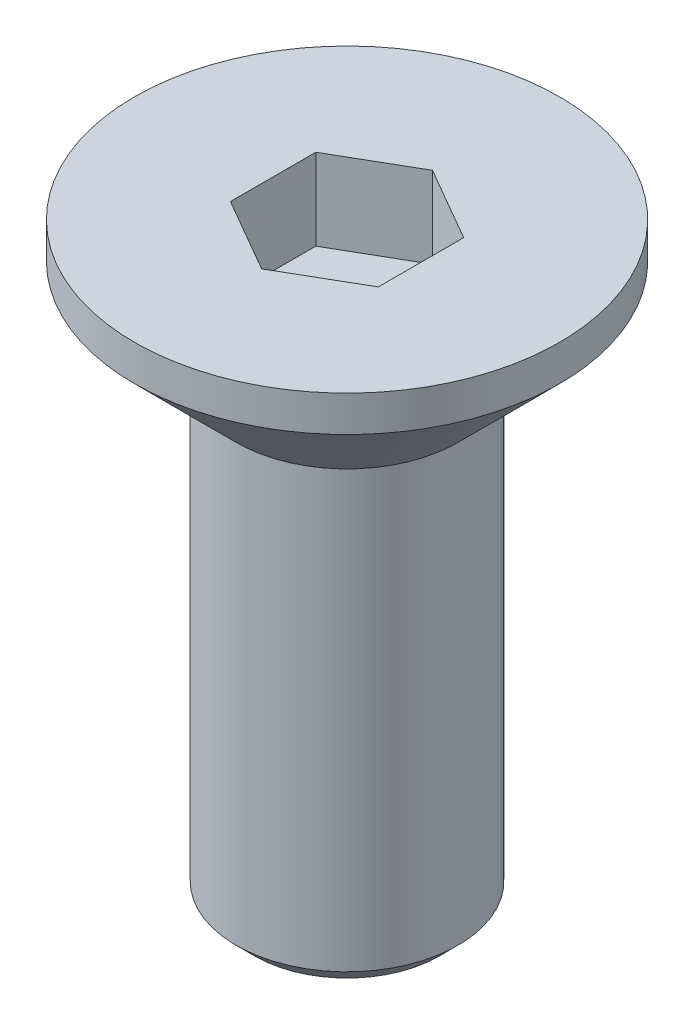
from build123d import *

# Parameters (mm, degrees)
CUT_EXTRUDE1_DEPTH = 1.1


with BuildPart() as part:
    # Sketch1 → Revolve1 (revolve)
    with BuildSketch(Plane.XY):
        Polygon((0, 0), (0, -8), (-1.25, -8), (-1.5, -7.75), (-1.5, -1.86), (-2.875, -0.485), (-2.875, 0), align=None)
    revolve(axis=Axis((0, 0, 0), (0, -1, 0)))

    # Sketch2 → Cut-Extrude1 (cut)
    with BuildSketch(Plane(origin=(0, 0, 0), x_dir=(1, 0, 0), z_dir=(0, 1, 0))):
        Polygon((-1, 0.577350269), (-1, -0.577350269), (0, -1.154700538), (1, -0.577350269), (1, 0.577350269), (0, 1.154700538), align=None)
    extrude(amount=-CUT_EXTRUDE1_DEPTH, mode=Mode.SUBTRACT)


solid = part.part
